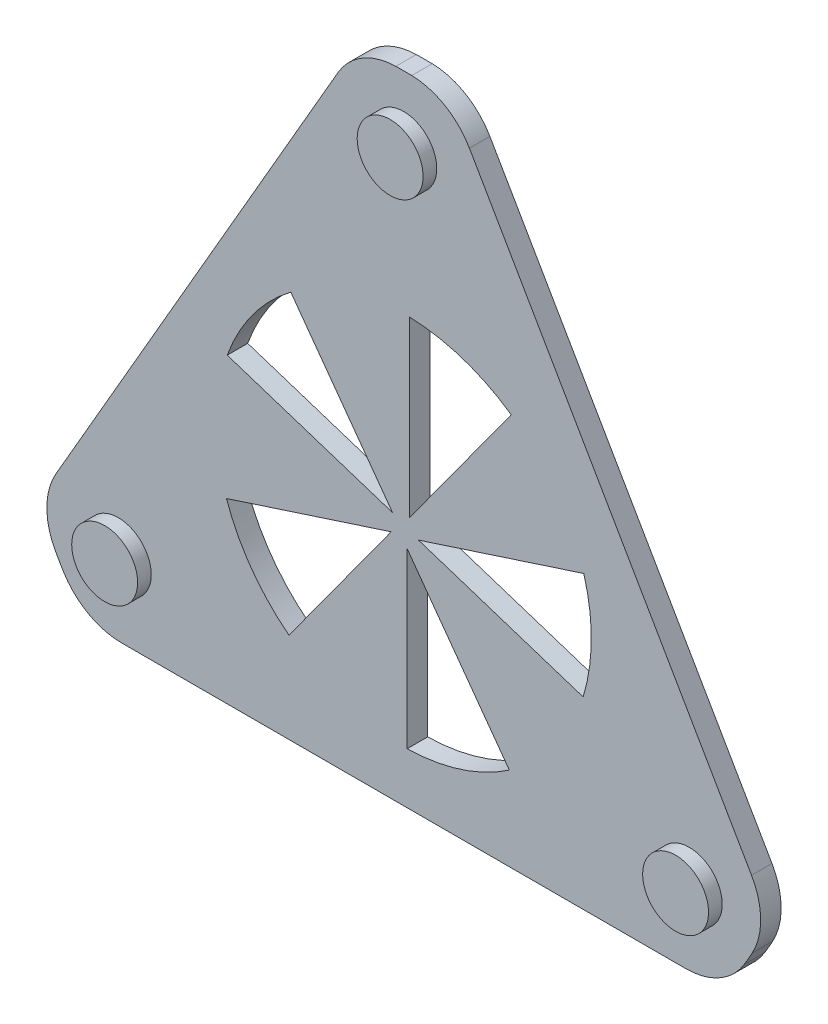
from build123d import *

# Parameters (mm, degrees)
SKETCH2_R           = 18
BOSS_EXTRUDE1_DEPTH = 1.8
BOSS_EXTRUDE7_START = -1.8
BOSS_EXTRUDE7_DEPTH = 1.8
SKETCH17_R          = 0.7
BOSS_EXTRUDE9_DEPTH = 1.8
BOSS_EXTRUDE2_START = -1.8
SKETCH3_R           = 35
SKETCH3_R_2         = 18
BOSS_EXTRUDE2_DEPTH = 1.8
SKETCH4_R           = 2.9
BOSS_EXTRUDE3_DEPTH = 3
SKETCH6_R           = 5
BOSS_EXTRUDE4_DEPTH = 1
SKETCH7_R           = 59.131365533
CUT_EXTRUDE1_DEPTH  = 10
FILLET1_R           = 6


with BuildPart() as part:
    # Sketch2 → Boss-Extrude1 (new body)
    with BuildSketch(Plane.XY.offset(10)):
        Circle(SKETCH2_R)
        with BuildLine():
            ThreePointArc((0, 0.538550206), (0.166421166, 0.512191682), (0.316551869, 0.435696269))
            Line((0.316551869, 0.435696269), (9.992349289, 13.753288904))
            ThreePointArc((9.992349289, 13.753288904), (13.753288904, 9.992349289), (16.167960777, 5.253288904))
            Line((16.167960777, 5.253288904), (0.512191682, 0.166421166))
            ThreePointArc((0.512191682, 0.166421166), (0.538550206, 0), (0.512191682, -0.166421166))
            Line((0.512191682, -0.166421166), (16.167960777, -5.253288904))
            ThreePointArc((16.167960777, -5.253288904), (13.753288904, -9.992349289), (9.992349289, -13.753288904))
            Line((9.992349289, -13.753288904), (0.316551869, -0.435696269))
            ThreePointArc((0.316551869, -0.435696269), (0.166421166, -0.512191682), (0, -0.538550206))
            Line((0, -0.538550206), (0, -17))
            ThreePointArc((0, -17), (-5.253288904, -16.167960777), (-9.992349289, -13.753288904))
            Line((-9.992349289, -13.753288904), (-0.316551869, -0.435696269))
            ThreePointArc((-0.316551869, -0.435696269), (-0.435696269, -0.316551869), (-0.512191682, -0.166421166))
            Line((-0.512191682, -0.166421166), (-16.167960777, -5.253288904))
            ThreePointArc((-16.167960777, -5.253288904), (-17, 0), (-16.167960777, 5.253288904))
            Line((-16.167960777, 5.253288904), (-0.512191682, 0.166421166))
            ThreePointArc((-0.512191682, 0.166421166), (-0.435696269, 0.316551869), (-0.316551869, 0.435696269))
            Line((-0.316551869, 0.435696269), (-9.992349289, 13.753288904))
            ThreePointArc((-9.992349289, 13.753288904), (-5.253288904, 16.167960777), (0, 17))
            Line((0, 17), (0, 0.538550206))
        make_face(mode=Mode.SUBTRACT)
        with BuildLine():
            Line((0.5, 1.198581445), (0.5, 16.492422502))
            ThreePointArc((0.5, 16.492422502), (5.193820321, 15.661233364), (9.454148381, 13.522909391))
            Line((9.454148381, 13.522909391), (0.5, 1.198581445))
        make_face(mode=Mode.SUBTRACT)
        with BuildLine():
            Line((-9.939558578, 13.170238239), (-0.985410197, 0.845910294))
            Line((-0.985410197, 0.845910294), (-15.530717393, 5.57196709))
            ThreePointArc((-15.530717393, 5.57196709), (-13.289739299, 9.779203923), (-9.939558578, 13.170238239))
        make_face(mode=Mode.SUBTRACT)
        with BuildLine():
            Line((-15.597133416, -5.383254519), (-1.109016994, -0.675780132))
            Line((-1.109016994, -0.675780132), (-10.098511219, -13.048757457))
            ThreePointArc((-10.098511219, -13.048757457), (-13.40733091, -9.617352956), (-15.597133416, -5.383254519))
        make_face(mode=Mode.SUBTRACT)
        with BuildLine():
            ThreePointArc((9.289494224, -13.636542709), (5.003553098, -15.723054932), (0.3, -16.497272502))
            Line((0.3, -16.497272502), (0.3, -1.263565384))
            Line((0.3, -1.263565384), (9.289494224, -13.636542709))
        make_face(mode=Mode.SUBTRACT)
        with BuildLine():
            Line((15.782543612, -4.812620609), (1.294427191, -0.105146222))
            Line((1.294427191, -0.105146222), (15.839734388, 4.620910574))
            ThreePointArc((15.839734388, 4.620910574), (16.499696789, -0.100029399), (15.782543612, -4.812620609))
        make_face(mode=Mode.SUBTRACT)
    extrude(amount=-BOSS_EXTRUDE1_DEPTH)

    # Sketch11 → Boss-Extrude7 (add)
    with BuildSketch(Plane(origin=(0, 0, 8.2), x_dir=(-1, 0, 0), z_dir=(0, 0, -1)).offset(BOSS_EXTRUDE7_START)):
        with BuildLine():
            ThreePointArc((-0.512191682, 0.166421166), (-0.435696269, 0.316551869), (-0.316551869, 0.435696269))
            Line((-0.316551869, 0.435696269), (-9.992349289, 13.753288904))
            ThreePointArc((-9.992349289, 13.753288904), (-13.753288904, 9.992349289), (-16.167960777, 5.253288904))
            Line((-16.167960777, 5.253288904), (-0.512191682, 0.166421166))
        make_face()
        with BuildLine():
            Line((0, 17), (0, 0.538550206))
            ThreePointArc((0, 0.538550206), (0.166421166, 0.512191682), (0.316551869, 0.435696269))
            Line((0.316551869, 0.435696269), (9.992349289, 13.753288904))
            ThreePointArc((9.992349289, 13.753288904), (5.253288904, 16.167960777), (0, 17))
        make_face()
        with BuildLine():
            Line((16.167960777, 5.253288904), (0.512191682, 0.166421166))
            ThreePointArc((0.512191682, 0.166421166), (0.531919759, 0.084247813), (0.538550206, 0))
            ThreePointArc((0.538550206, 0), (0.531919759, -0.084247813), (0.512191682, -0.166421166))
            Line((0.512191682, -0.166421166), (16.167960777, -5.253288904))
            ThreePointArc((16.167960777, -5.253288904), (17, 0), (16.167960777, 5.253288904))
        make_face()
        with BuildLine():
            Line((9.992349289, -13.753288904), (0.316551869, -0.435696269))
            ThreePointArc((0.316551869, -0.435696269), (0.166421166, -0.512191682), (0, -0.538550206))
            Line((0, -0.538550206), (0, -17))
            ThreePointArc((0, -17), (5.253288904, -16.167960777), (9.992349289, -13.753288904))
        make_face()
        with BuildLine():
            ThreePointArc((-0.316551869, -0.435696269), (-0.435696269, -0.316551869), (-0.512191682, -0.166421166))
            Line((-0.512191682, -0.166421166), (-16.167960777, -5.253288904))
            ThreePointArc((-16.167960777, -5.253288904), (-13.753288904, -9.992349289), (-9.992349289, -13.753288904))
            Line((-9.992349289, -13.753288904), (-0.316551869, -0.435696269))
        make_face()
        with BuildLine():
            ThreePointArc((0.316551869, 0.435696269), (0.166421166, 0.512191682), (0, 0.538550206))
            ThreePointArc((0, 0.538550206), (-0.166421166, 0.512191682), (-0.316551869, 0.435696269))
            ThreePointArc((-0.316551869, 0.435696269), (-0.435696269, 0.316551869), (-0.512191682, 0.166421166))
            ThreePointArc((-0.512191682, 0.166421166), (-0.538550206, 0), (-0.512191682, -0.166421166))
            ThreePointArc((-0.512191682, -0.166421166), (-0.435696269, -0.316551869), (-0.316551869, -0.435696269))
            ThreePointArc((-0.316551869, -0.435696269), (-0.166421166, -0.512191682), (0, -0.538550206))
            ThreePointArc((0, -0.538550206), (0.166421166, -0.512191682), (0.316551869, -0.435696269))
            ThreePointArc((0.316551869, -0.435696269), (0.435696269, -0.316551869), (0.512191682, -0.166421166))
            ThreePointArc((0.512191682, -0.166421166), (0.531919759, -0.084247813), (0.538550206, 0))
            ThreePointArc((0.538550206, 0), (0.531919759, 0.084247813), (0.512191682, 0.166421166))
            ThreePointArc((0.512191682, 0.166421166), (0.435696269, 0.316551869), (0.316551869, 0.435696269))
        make_face()
    extrude(amount=BOSS_EXTRUDE7_DEPTH)

    # Sketch17 → Boss-Extrude9 (add)
    with BuildSketch(Plane(origin=(0, 0, 8.2), x_dir=(-1, 0, 0), z_dir=(0, 0, -1))):
        Circle(SKETCH17_R)
    extrude(amount=-BOSS_EXTRUDE9_DEPTH)

    # Sketch3 → Boss-Extrude2 (add)
    with BuildSketch(Plane(origin=(0, 0, 8.2), x_dir=(-1, 0, 0), z_dir=(0, 0, -1)).offset(BOSS_EXTRUDE2_START)):
        Circle(SKETCH3_R)
        Circle(SKETCH3_R_2, mode=Mode.SUBTRACT)
    extrude(amount=BOSS_EXTRUDE2_DEPTH)

    # Sketch4 → Boss-Extrude3 (add)
    with BuildSketch(Plane(origin=(0, 0, 8.2), x_dir=(-1, 0, 0), z_dir=(0, 0, -1))):
        with Locations((0, 29)):
            Circle(SKETCH4_R)
        with Locations((25.11473671, -14.5)):
            Circle(SKETCH4_R)
        with Locations((-25.11473671, -14.5)):
            Circle(SKETCH4_R)
    extrude(amount=-BOSS_EXTRUDE3_DEPTH)

    # Sketch6 → Boss-Extrude4 (add)
    with BuildSketch(Plane(origin=(0, 0, 10), x_dir=(-1, 0, 0), z_dir=(0, 0, -1))):
        with Locations((0, 30)):
            Circle(SKETCH6_R)
        with Locations((25.980762114, -15)):
            Circle(SKETCH6_R)
        with Locations((-25.980762114, -15)):
            Circle(SKETCH6_R)
    extrude(amount=BOSS_EXTRUDE4_DEPTH)

    # Sketch7 → Cut-Extrude1 (cut)
    with BuildSketch(Plane(origin=(0, 0, 8.2), x_dir=(-1, 0, 0), z_dir=(0, 0, -1))):
        Circle(SKETCH7_R)
        Polygon((0, 42), (-36.373066959, -21), (36.373066959, -21), align=None, mode=Mode.SUBTRACT)
    extrude(amount=-CUT_EXTRUDE1_DEPTH, mode=Mode.SUBTRACT)

    # Fillet1
    fillet1_edges = [part.edges().sort_by_distance(p)[0] for p in [
        (4.186533479, 34.748711306, 9.1),
        (32.186533479, -13.748711306, 9.1),
        (28, -21, 9.1),
        (-28, -21, 9.1),
        (-32.186533479, -13.748711306, 9.1),
        (-4.186533479, 34.748711306, 9.1),
    ]]
    fillet(fillet1_edges, radius=FILLET1_R)


solid = part.part
